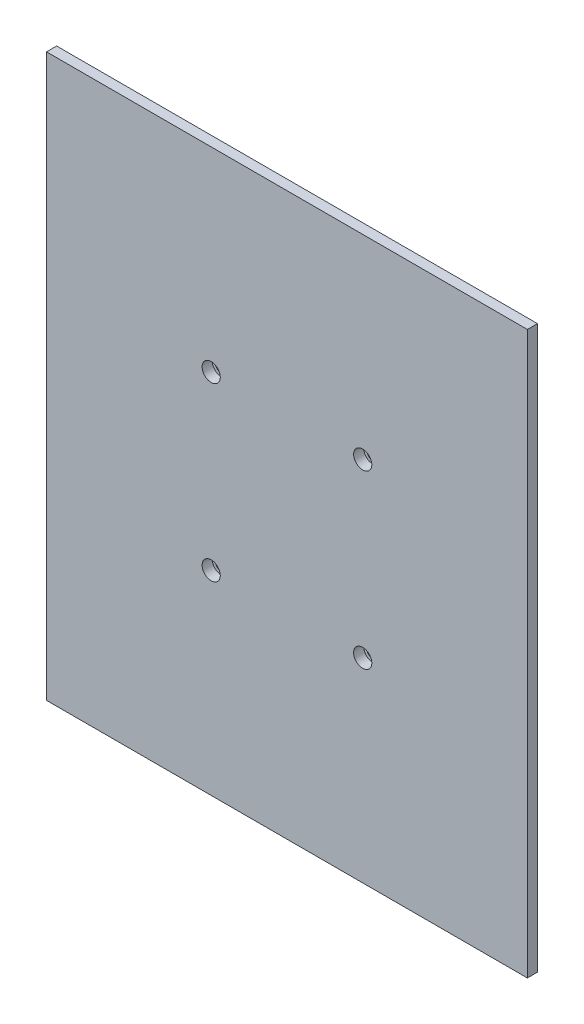
from build123d import *

# Parameters (mm, degrees)
SKETCH_1_W          = 95
SKETCH_1_H          = 105
EXTRUDE_3_DEPTH     = 10
SKETCH_10_R         = 4.5
CUT_EXTRUDE_4_DEPTH = 5
EXTRUDE_4_DEPTH     = 5
SKETCH_13_W         = 238
SKETCH_13_H         = 278
SKETCH_13_W_2       = 228
SKETCH_13_H_2       = 268
EXTRUDE_5_DEPTH     = 30
SKETCH_14_W         = 238
SKETCH_14_H         = 278
SKETCH_14_W_2       = 228
SKETCH_14_H_2       = 268
EXTRUDE_6_DEPTH     = 5
SKETCH_17_W         = 464.866912847
SKETCH_17_H         = 477.250662574
CUT_EXTRUDE_5_DEPTH = 30
SKETCH_10_2_R       = 4.5
CUT_EXTRUDE_6_DEPTH = 10
SKETCH_19_R         = 4.5
SKETCH_19_R_2       = 3
EXTRUDE_7_DEPTH     = 5


with BuildPart() as part:
    # 草图1 → 凸台-拉伸3 (new body)
    with BuildSketch(Plane.XY):
        with Locations((47.5, -52.5)):
            Rectangle(SKETCH_1_W, SKETCH_1_H)
    extrude(amount=EXTRUDE_3_DEPTH)

    # 草图10 → 切除-拉伸4 (cut)
    with BuildSketch(Plane(origin=(0, 0, 0), x_dir=(-1, 0, 0), z_dir=(0, 0, -1))):
        with Locations((-85, -10)):
            Circle(SKETCH_10_R)
        with Locations((-85, -95)):
            Circle(SKETCH_10_R)
        with Locations((-10, -95)):
            Circle(SKETCH_10_R)
        with Locations((-10, -10)):
            Circle(SKETCH_10_R)
    extrude(amount=-CUT_EXTRUDE_4_DEPTH, mode=Mode.SUBTRACT)

    # 草图12 → 凸台-拉伸4 (add)
    with BuildSketch(Plane.XY.offset(10)):
        Polygon((47.5, 81.5), (161.5, 81.5), (161.5, -186.5), (-66.5, -186.5), (-66.5, 81.5), align=None)
    extrude(amount=-EXTRUDE_4_DEPTH)



with BuildPart() as body_2:
    # 草图13 → 凸台-拉伸5 (new body)
    with BuildSketch(Plane.XY.offset(10)):
        with Locations((47.5, -52.5)):
            Rectangle(SKETCH_13_W, SKETCH_13_H)
        with Locations((47.5, -52.5)):
            Rectangle(SKETCH_13_W_2, SKETCH_13_H_2, mode=Mode.SUBTRACT)
    extrude(amount=EXTRUDE_5_DEPTH)


with BuildPart() as part_1:
    add(part.part)

    add(body_2.part)  # 凸台-拉伸6 merges body 2
    # 草图14 → 凸台-拉伸6 (add)
    with BuildSketch(Plane(origin=(0, 0, 5), x_dir=(-1, 0, 0), z_dir=(0, 0, -1))):
        with Locations((-47.5, -52.5)):
            Rectangle(SKETCH_14_W, SKETCH_14_H)
        with Locations((-47.5, -52.5)):
            Rectangle(SKETCH_14_W_2, SKETCH_14_H_2, mode=Mode.SUBTRACT)
    extrude(amount=-EXTRUDE_6_DEPTH)

    # 草图17 → 切除-拉伸5 (cut)
    with BuildSketch(Plane.XY.offset(40)):
        with Locations((32.258461874, -38.211058007)):
            Rectangle(SKETCH_17_W, SKETCH_17_H)
    extrude(amount=-CUT_EXTRUDE_5_DEPTH, mode=Mode.SUBTRACT)

    # 草图10<2> → 切除-拉伸6 (cut)
    with BuildSketch(Plane(origin=(0, 0, 0), x_dir=(-1, 0, 0), z_dir=(0, 0, -1))):
        with Locations((-85, -10)):
            Circle(SKETCH_10_2_R)
        with Locations((-85, -95)):
            Circle(SKETCH_10_2_R)
        with Locations((-10, -95)):
            Circle(SKETCH_10_2_R)
        with Locations((-10, -10)):
            Circle(SKETCH_10_2_R)
    extrude(amount=-CUT_EXTRUDE_6_DEPTH, mode=Mode.SUBTRACT)

    # 草图19 → 凸台-拉伸7 (add)
    # profile 1 of 4: a face of its own
    with BuildSketch(Plane(origin=(0, 0, 0), x_dir=(-1, 0, 0), z_dir=(0, 0, -1))):
        with Locations((-85, -10)):
            Circle(SKETCH_19_R)
        with Locations((-85, -10)):
            Circle(SKETCH_19_R_2, mode=Mode.SUBTRACT)
    # profile 2 of 4: a face of its own
    with BuildSketch(Plane(origin=(0, 0, 0), x_dir=(-1, 0, 0), z_dir=(0, 0, -1))):
        with Locations((-10, -10)):
            Circle(SKETCH_19_R)
        with Locations((-10, -10)):
            Circle(SKETCH_19_R_2, mode=Mode.SUBTRACT)
    # profile 3 of 4: a face of its own
    with BuildSketch(Plane(origin=(0, 0, 0), x_dir=(-1, 0, 0), z_dir=(0, 0, -1))):
        with Locations((-85, -95)):
            Circle(SKETCH_19_R)
        with Locations((-85, -95)):
            Circle(SKETCH_19_R_2, mode=Mode.SUBTRACT)
    # profile 4 of 4: a face of its own
    with BuildSketch(Plane(origin=(0, 0, 0), x_dir=(-1, 0, 0), z_dir=(0, 0, -1))):
        with Locations((-10, -95)):
            Circle(SKETCH_19_R)
        with Locations((-10, -95)):
            Circle(SKETCH_19_R_2, mode=Mode.SUBTRACT)
    extrude(amount=-EXTRUDE_7_DEPTH)


solid = part_1.part
